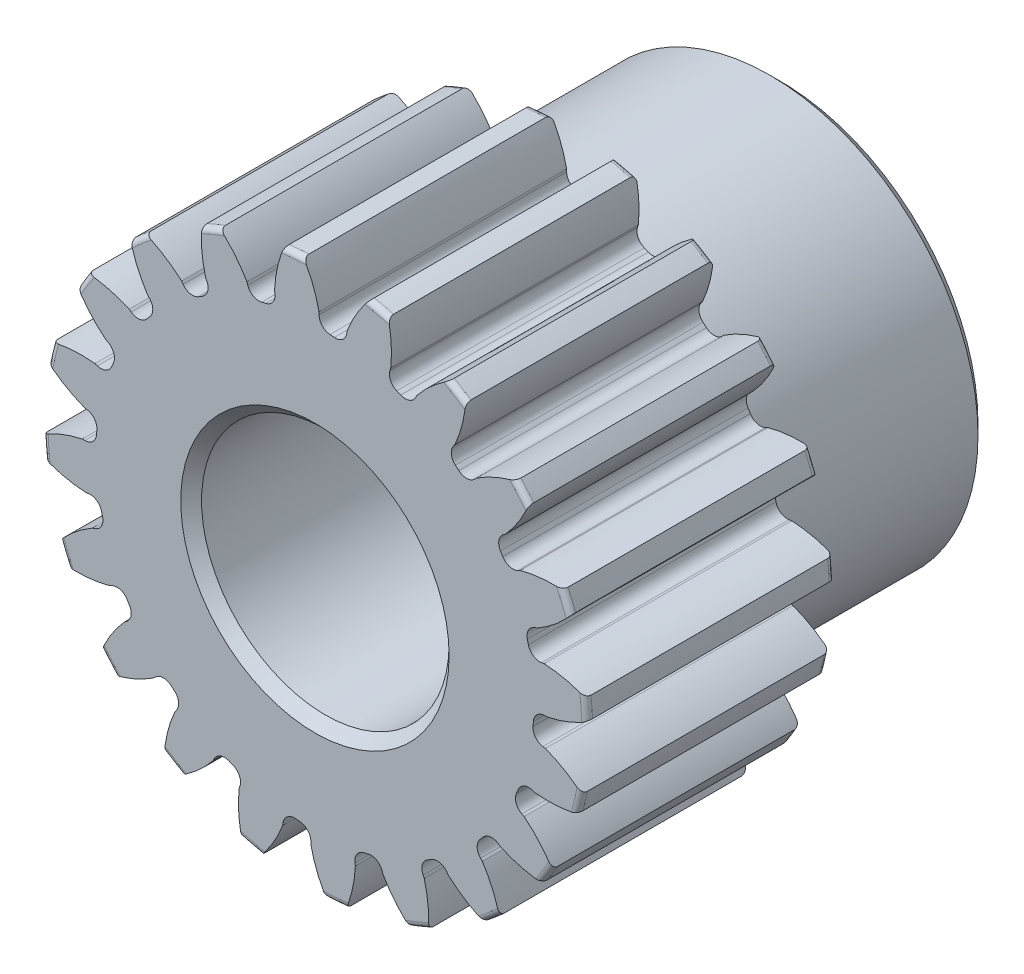
from build123d import *

# Parameters (mm, degrees)
SKETCH1_R                = 13.97
BOSS_EXTRUDE1_DEPTH      = 12.7
SKETCH2_W                = 11.176
SKETCH2_H                = 10.668
FILLET2_R                = 0.2794
CUT_EXTRUDE1_DEPTH       = 31.990081987
FILLET1_R                = 0.5984748
CIRPATTERN1_COUNT        = 20
FILLET1_OF_CIRPATTERN1_R = 0.5984748
SKETCH5_R                = 6.35
CUT_EXTRUDE2_DEPTH       = 31.978829136
CHAMFER1_SIZE            = 0.5334


with BuildPart() as part:
    # Sketch1 → Boss-Extrude1 (new body)
    with BuildSketch(Plane.XY):
        Circle(SKETCH1_R)
    extrude(amount=-BOSS_EXTRUDE1_DEPTH)

    # Sketch2 → Revolve1 (revolve)
    with BuildSketch(Plane(origin=(0, 0, 0), x_dir=(0, 0, -1), z_dir=(1, 0, 0)), mode=Mode.PRIVATE) as revolve1_sk:
        with Locations((18.288, 5.334)):
            Rectangle(SKETCH2_W, SKETCH2_H)
    revolve(revolve1_sk.sketch.rotate(Axis((0, 0, -12.7), (0, 0, -1)), 90), axis=Axis((0, 0, -12.7), (0, 0, -1)))

    # Fillet2
    fillet2_edges = [part.edges().sort_by_distance(p)[0] for p in [
        (-13.97, 0, 0),
        (-13.97, 0, -12.7),
        (-10.668, 0, -12.7),
    ]]
    fillet(fillet2_edges, radius=FILLET2_R)

    # Sketch4 → Cut-Extrude1 (cut, through all)
    with BuildSketch(Plane.XY):
        with BuildLine():
            Line((0.210823499, 11.932233972), (0.210823499, 11.228631013))
            ThreePointArc((0.210823499, 11.228631013), (0.881145561, 11.195989616), (1.54832106, 11.123367425))
            Line((1.54832106, 11.123367425), (1.658389068, 11.818307824))
            add(Edge.make_bspline(
                [(5.904499611, 15.819097373), (2.715567633, 14.578951978), (1.658389068, 11.818307824)],
                knots=[0, 0, 0, 1, 1, 1], degree=2))
            ThreePointArc((5.904499611, 15.819097373), (1.324793594, 16.833059119), (-3.35714731, 16.548006506))
            add(Edge.make_bspline(
                [(-3.35714731, 16.548006506), (-0.40147849, 14.824269404), (0.210823499, 11.932233972)],
                knots=[0, 0, 0, 1, 1, 1], degree=2))
        make_face()
    cut_extrude1 = extrude(amount=-CUT_EXTRUDE1_DEPTH, mode=Mode.SUBTRACT)

    # Fillet1
    fillet1_edges = [part.edges().sort_by_distance(p)[0] for p in [
        (1.54832106, 11.123367425, -6.35),
        (0.210823499, 11.228631013, -6.35),
    ]]
    fillet(fillet1_edges, radius=FILLET1_R)

    # CirPattern1: Cut-Extrude1 ×20 about axis
    cirpattern1_axis = Axis((0, 0, -12.7), (0, 0, 1))
    for i in range(1, CIRPATTERN1_COUNT):
        add(cut_extrude1.rotate(cirpattern1_axis, i * 360 / CIRPATTERN1_COUNT), mode=Mode.SUBTRACT)

    # Fillet1 of CirPattern1
    fillet1_of_cirpattern1_edges = [part.edges().sort_by_distance(p)[0] for p in [
        (-1.964768736, 11.057408593, -6.35),
        (-3.269332744, 10.744210738, -6.35),
        (-5.285533278, 9.909073566, -6.35),
        (-6.429463919, 9.208072256, -6.35),
        (-8.088912997, 7.790769378, -6.35),
        (-8.96023437, 6.770583506, -6.35),
        (-10.100493552, 4.909850402, -6.35),
        (-10.61391465, 3.670342869, -6.35),
        (-11.123367425, 1.54832106, -6.35),
        (-11.228631013, 0.210823499, -6.35),
        (-11.057408593, -1.964768736, -6.35),
        (-10.744210738, -3.269332744, -6.35),
        (-9.909073566, -5.285533278, -6.35),
        (-9.208072256, -6.429463919, -6.35),
        (-7.790769378, -8.088912997, -6.35),
        (-6.770583506, -8.96023437, -6.35),
        (-4.909850402, -10.100493552, -6.35),
        (-3.670342869, -10.61391465, -6.35),
        (-1.54832106, -11.123367425, -6.35),
        (-0.210823499, -11.228631013, -6.35),
        (1.964768736, -11.057408593, -6.35),
        (3.269332744, -10.744210738, -6.35),
        (5.285533278, -9.909073566, -6.35),
        (6.429463919, -9.208072256, -6.35),
        (8.088912997, -7.790769378, -6.35),
        (8.96023437, -6.770583506, -6.35),
        (10.100493552, -4.909850402, -6.35),
        (10.61391465, -3.670342869, -6.35),
        (11.123367425, -1.54832106, -6.35),
        (11.228631013, -0.210823499, -6.35),
        (11.057408593, 1.964768736, -6.35),
        (10.744210738, 3.269332744, -6.35),
        (9.909073566, 5.285533278, -6.35),
        (9.208072256, 6.429463919, -6.35),
        (7.790769378, 8.088912997, -6.35),
        (6.770583506, 8.96023437, -6.35),
        (4.909850402, 10.100493552, -6.35),
        (3.670342869, 10.61391465, -6.35),
    ]]
    fillet(fillet1_of_cirpattern1_edges, radius=FILLET1_OF_CIRPATTERN1_R)

    # Sketch5 → Cut-Extrude2 (cut, through all)
    with BuildSketch(Plane.XY):
        Circle(SKETCH5_R)
    extrude(amount=-CUT_EXTRUDE2_DEPTH, mode=Mode.SUBTRACT)

    # Chamfer1
    chamfer1_edges = [part.edges().sort_by_distance(p)[0] for p in [
        (-10.668, 0, -23.876),
        (-6.35, 0, -23.876),
        (-6.35, 0, 0),
    ]]
    chamfer(chamfer1_edges, length=CHAMFER1_SIZE)


solid = part.part
